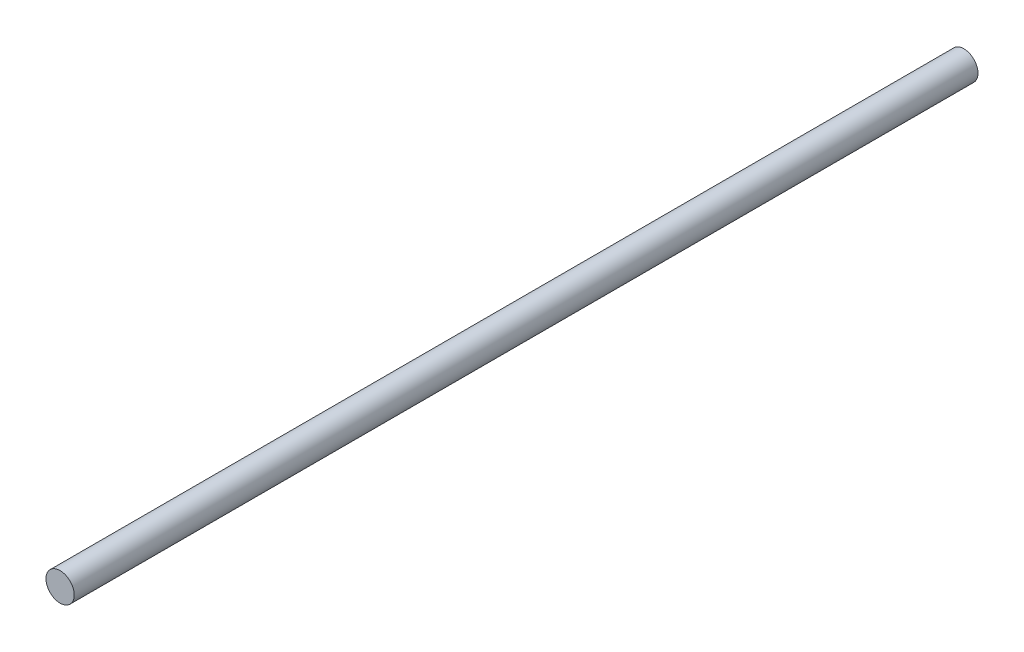
from build123d import *

# Parameters (mm, degrees)
ESQUISSE1_R        = 1.5875
BOSS_EXTRU_1_DEPTH = 101.6


with BuildPart() as part:
    # Esquisse1 → Boss.-Extru.1 (new body)
    with BuildSketch(Plane.XY):
        Circle(ESQUISSE1_R)
    extrude(amount=BOSS_EXTRU_1_DEPTH)


solid = part.part
